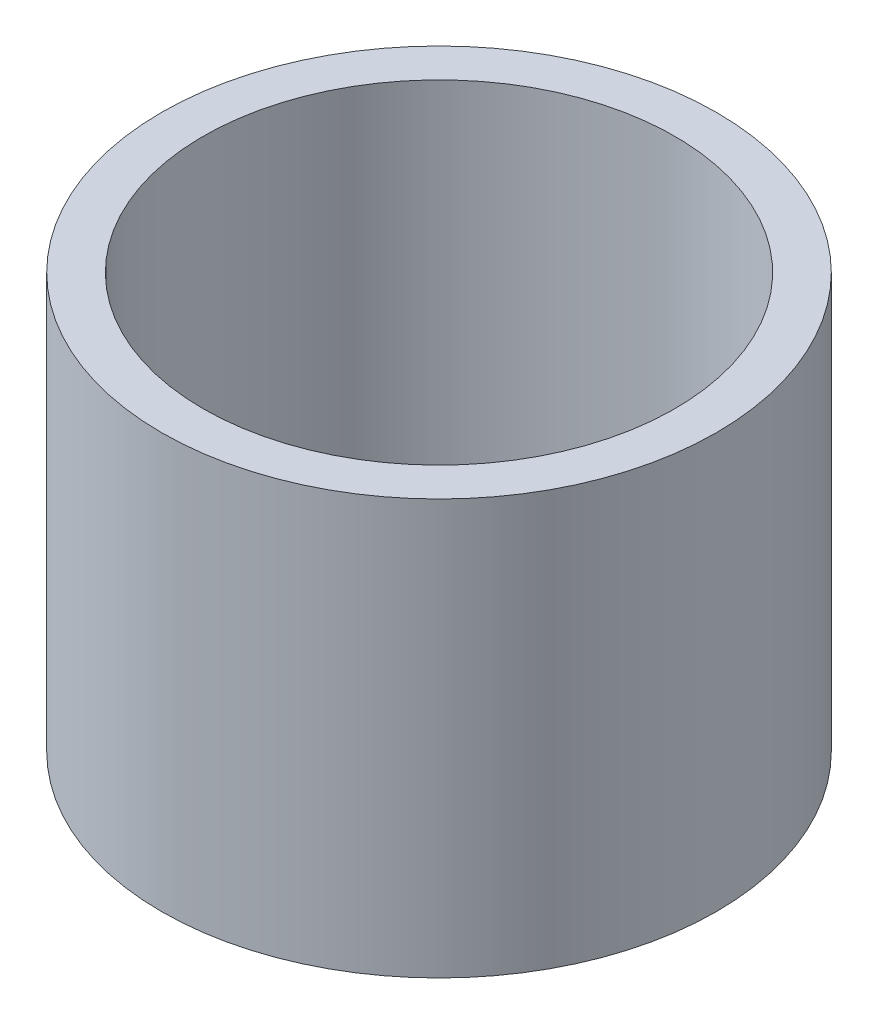
from build123d import *

# Parameters (mm, degrees)
SKETCH_1_R          = 21.4
EXTRUDE_1_DEPTH     = 32
SKETCH_2_R          = 18.2
CUT_EXTRUDE_1_DEPTH = 45.044522929


with BuildPart() as part:
    # 草图1 → 凸台-拉伸1 (new body)
    with BuildSketch(Plane(origin=(0, 0, 0), x_dir=(1, 0, 0), z_dir=(0, 1, 0))):
        with Locations(Location((0, 0, 0), (0, 0, 270))):
            Circle(SKETCH_1_R)
    extrude(amount=EXTRUDE_1_DEPTH)

    # 草图2 → 切除-拉伸1 (cut, through all)
    with BuildSketch(Plane(origin=(0, 32, 0), x_dir=(1, 0, 0), z_dir=(0, 1, 0))):
        with Locations(Location((0, 0, 0), (0, 0, 270))):
            Circle(SKETCH_2_R)
    extrude(amount=-CUT_EXTRUDE_1_DEPTH, mode=Mode.SUBTRACT)


solid = part.part
